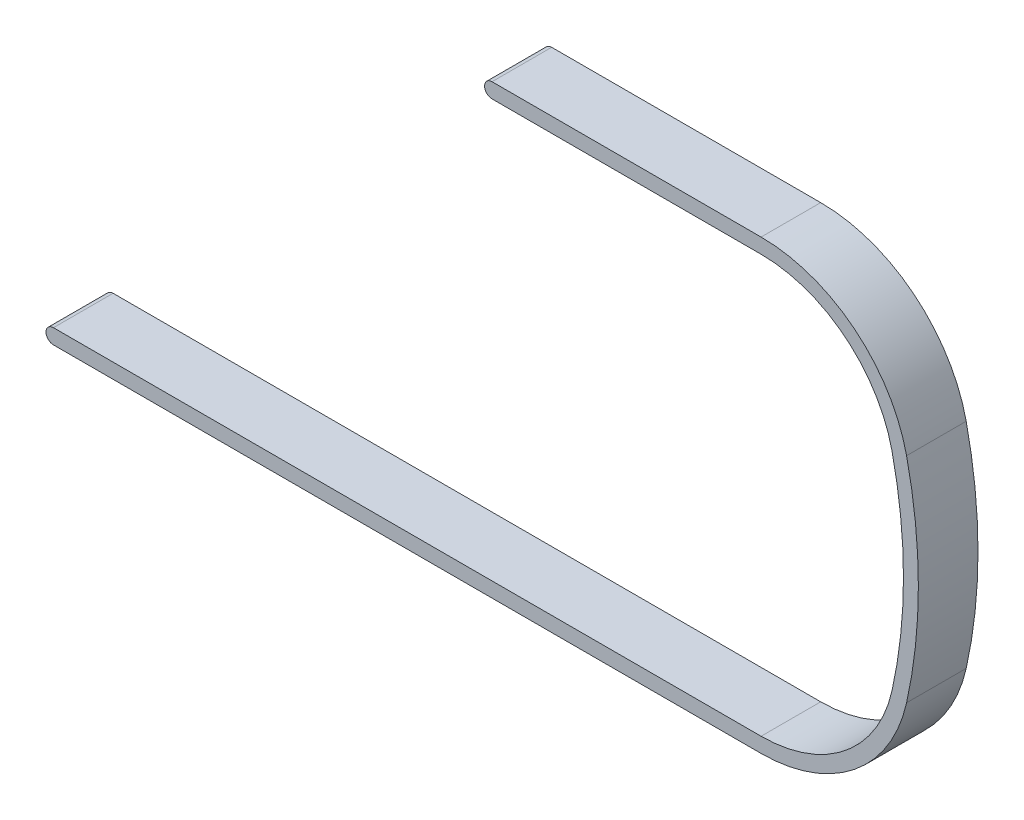
from build123d import *

# Parameters (mm, degrees)
BOSS_EXTRUDE1_DEPTH = 40


with BuildPart() as part:
    # Sketch1 → Boss-Extrude1 (new body)
    with BuildSketch(Plane.XY):
        with BuildLine():
            Line((-5.802272282, 50), (174.679242578, 50))
            ThreePointArc((174.679242578, 50), (237.215894164, 28.0331161), (272.277838453, -28.216655834))
            ThreePointArc((272.277838453, -28.216655834), (280.191261544, -100), (272.277838453, -171.783344166))
            ThreePointArc((272.277838453, -171.783344166), (237.215894164, -228.0331161), (174.679242578, -250))
            Line((174.679242578, -250), (-300, -250))
            ThreePointArc((-300, -250), (-305, -245), (-300, -240))
            Line((-300, -240), (174.679242578, -240))
            ThreePointArc((174.679242578, -240), (230.962229006, -220.22980449), (262.517978866, -169.60500975))
            ThreePointArc((262.517978866, -169.60500975), (270.191261544, -100), (262.517978866, -30.39499025))
            ThreePointArc((262.517978866, -30.39499025), (230.962229006, 20.22980449), (174.679242578, 40))
            Line((174.679242578, 40), (-5.802272282, 40))
            ThreePointArc((-5.802272282, 40), (-10.802272282, 45), (-5.802272282, 50))
        make_face()
    extrude(amount=BOSS_EXTRUDE1_DEPTH)


solid = part.part
